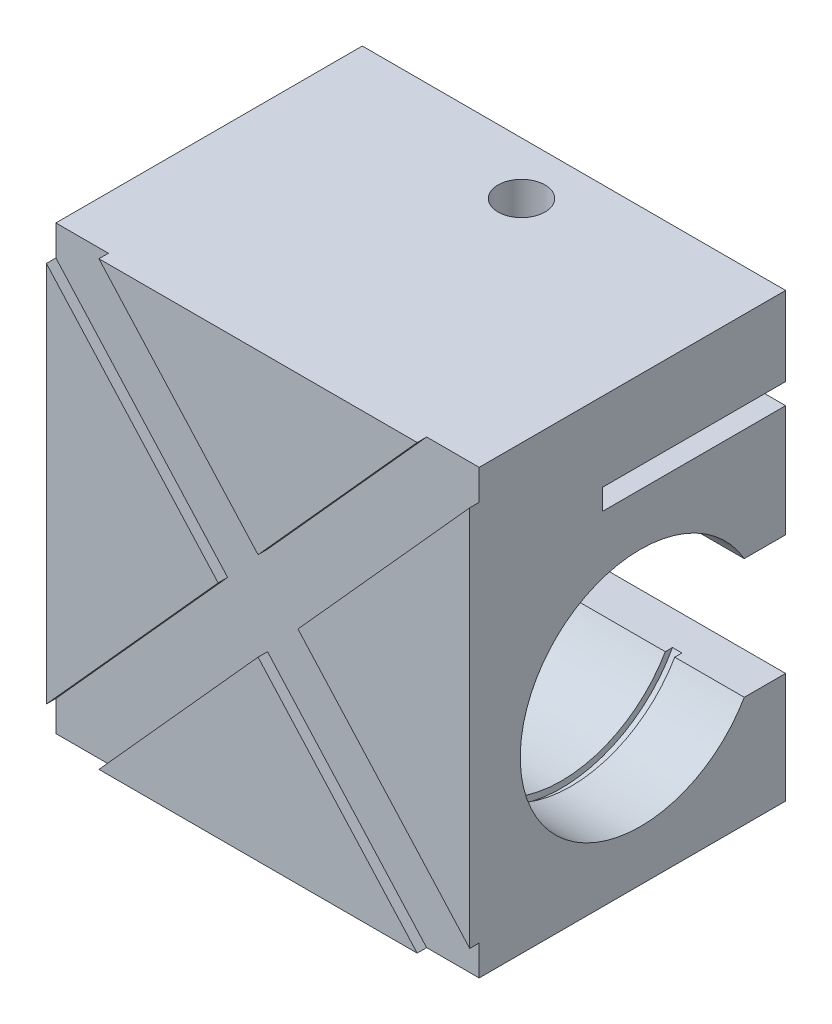
from build123d import *

# Parameters (mm, degrees)
SKETCH3_W               = 67
SKETCH3_H               = 50
BOSS_EXTRUDE1_DEPTH     = 70
CUT_EXTRUDE1_DEPTH      = 110.036691072
CUT_EXTRUDE1_DEPTH_BACK = 1.5
CUT_EXTRUDE3_DEPTH      = 110.036691072
SKETCH8_W               = 29
SKETCH8_H               = 3.3
CUT_EXTRUDE4_DEPTH      = 110.036691072
CUT_EXTRUDE5_REACH      = 111.037
SKETCH4_R               = 3.720223744
SKETCH9_R               = 20
CUT_EXTRUDE6_DEPTH      = 1.5
CUT_EXTRUDE7_START      = -1.5
SKETCH10_R              = 20
CUT_EXTRUDE7_DEPTH      = 1.5


with BuildPart() as part:
    # Sketch3 → Boss-Extrude1 (new body)
    with BuildSketch(Plane(origin=(0, 0, 0), x_dir=(1, 0, 0), z_dir=(0, 1, 0))):
        with Locations((33.5, 25)):
            Rectangle(SKETCH3_W, SKETCH3_H)
    extrude(amount=-BOSS_EXTRUDE1_DEPTH)

    # Sketch5 → Cut-Extrude1 (cut, two sides: drawn at the far end of the back side and taken through both)
    with BuildSketch(Plane.XY.offset(-CUT_EXTRUDE1_DEPTH_BACK)):
        Polygon((27.182851456, -35), (0, -65.2), (0, -70), (8.313843876, -70), (33.5, -42.018317645), (58.686156124, -70), (67, -70), (67, -65.2), (39.817148544, -35), (67, -4.8), (67, 0), (58.686156124, 0), (33.5, -27.981682355), (8.313843876, 0), (0, 0), (0, -4.8), align=None)
    extrude(amount=CUT_EXTRUDE1_DEPTH + CUT_EXTRUDE1_DEPTH_BACK, mode=Mode.SUBTRACT)

    # Sketch6 → Cut-Extrude3 (cut, through all)
    with BuildSketch(Plane(origin=(67, 0, 0), x_dir=(0, 0, -1), z_dir=(1, 0, 0))):
        with BuildLine():
            Line((43.454482672, -33.5), (50, -33.5))
            Line((50, -33.5), (50, -52.5))
            Line((50, -52.5), (43.454482672, -52.5))
            ThreePointArc((43.454482672, -52.5), (8, -43), (43.454482672, -33.5))
        make_face()
    extrude(amount=-CUT_EXTRUDE3_DEPTH, mode=Mode.SUBTRACT)

    # Sketch8 → Cut-Extrude4 (cut, through all)
    with BuildSketch(Plane(origin=(67, 0, 0), x_dir=(0, 0, -1), z_dir=(1, 0, 0))):
        with Locations((35.5, -14.15)):
            Rectangle(SKETCH8_W, SKETCH8_H)
    extrude(amount=-CUT_EXTRUDE4_DEPTH, mode=Mode.SUBTRACT)

    # Sketch4 → Cut-Extrude5 (cut, up to next)
    with BuildSketch(Plane(origin=(0, 0, 0), x_dir=(1, 0, 0), z_dir=(0, 1, 0)), mode=Mode.PRIVATE) as cut_extrude5_sk1:
        with Locations(Location((33.5, 41.7, 0), (0, 0, 270))):
            Circle(SKETCH4_R)
    cut_extrude5_tool1 = extrude(cut_extrude5_sk1.sketch, amount=-CUT_EXTRUDE5_REACH, mode=Mode.PRIVATE) & part.part
    add(cut_extrude5_tool1.solids().sort_by_distance((33.5, 0, -41.7))[0], mode=Mode.SUBTRACT)

    # Sketch9 → Cut-Extrude6 (cut)
    with BuildSketch(Plane(origin=(54.5, 0, 0), x_dir=(0, 0, -1), z_dir=(1, 0, 0))):
        with Locations((27, -43)):
            Circle(SKETCH9_R)
    extrude(amount=CUT_EXTRUDE6_DEPTH, mode=Mode.SUBTRACT)

    # Sketch10 → Cut-Extrude7 (cut)
    with BuildSketch(Plane(origin=(12.5, 0, 0), x_dir=(0, 0, -1), z_dir=(1, 0, 0)).offset(CUT_EXTRUDE7_START)):
        with Locations((27, -43)):
            Circle(SKETCH10_R)
    extrude(amount=CUT_EXTRUDE7_DEPTH, mode=Mode.SUBTRACT)


solid = part.part
